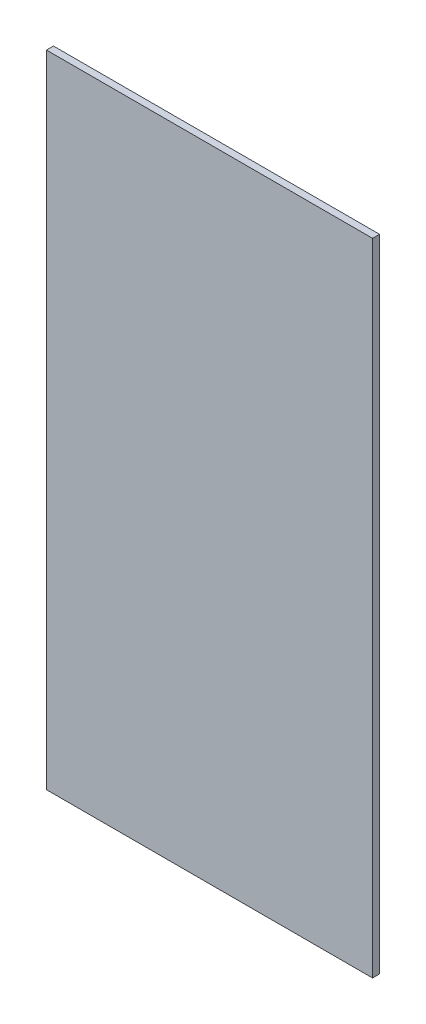
from build123d import *

# Parameters (mm, degrees)
SKETCH1_W           = 140
SKETCH1_H           = 275
BOSS_EXTRUDE1_DEPTH = 3


with BuildPart() as part:
    # Sketch1 → Boss-Extrude1 (new body)
    with BuildSketch(Plane.XY):
        Rectangle(SKETCH1_W, SKETCH1_H)
    extrude(amount=BOSS_EXTRUDE1_DEPTH)


solid = part.part
